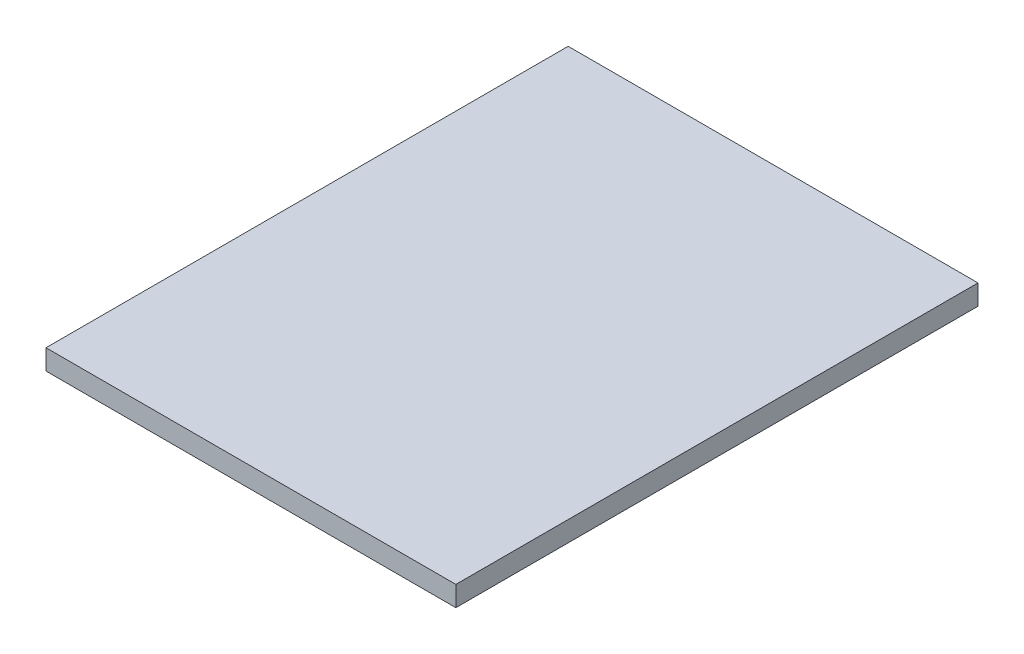
from build123d import *

# Parameters (mm, degrees)
SKETCH_1_W      = 365
SKETCH_1_H      = 465
EXTRUDE_1_DEPTH = 18


with BuildPart() as part:
    # Эскиз1 → Бобышка-Вытянуть1 (new body)
    with BuildSketch(Plane(origin=(0, 0, 0), x_dir=(1, 0, 0), z_dir=(0, 1, 0))):
        with Locations((31.071580902, -162.266443689)):
            Rectangle(SKETCH_1_W, SKETCH_1_H)
    extrude(amount=EXTRUDE_1_DEPTH)


solid = part.part
